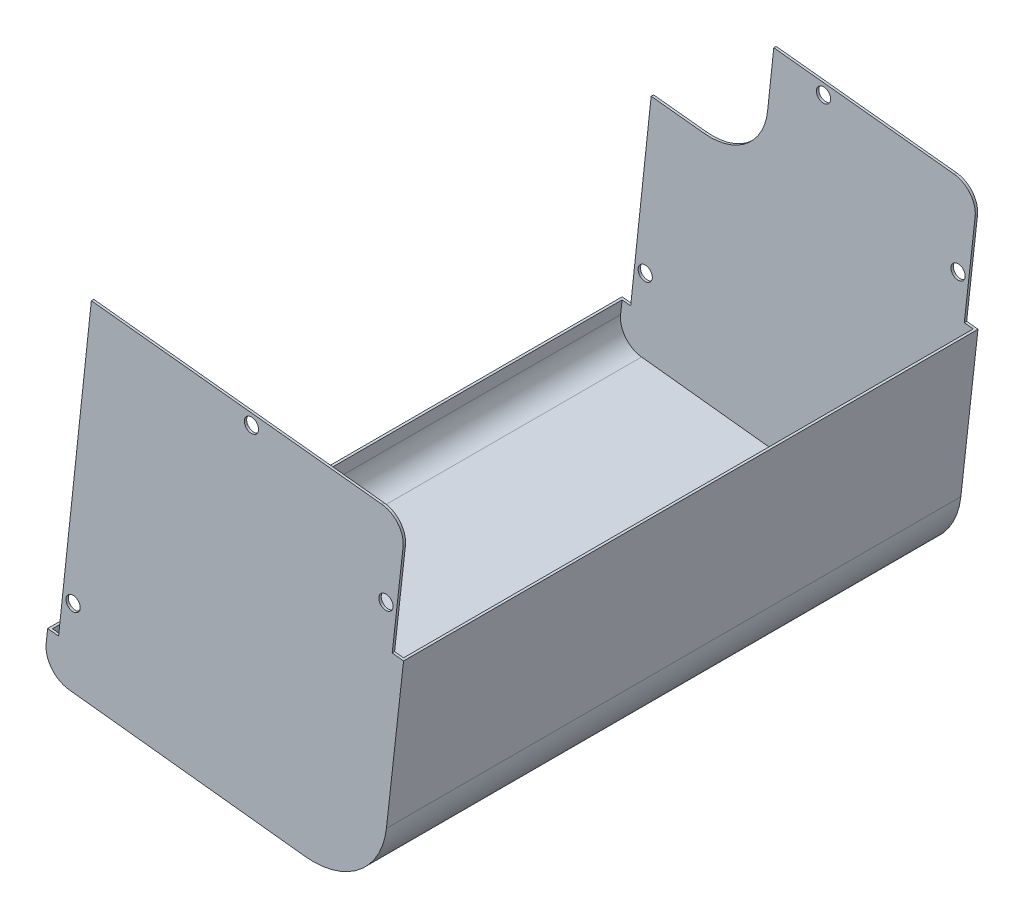
from build123d import *

# Parameters (mm, degrees)
EXTRUDE_1_DEPTH     = 240
SHELL_1_T           = 1
CUT_EXTRUDE_1_DEPTH = 10
SKETCH_3_R          = 3.0000000000000018
SKETCH_3_R_2        = 3.000000000000008
CUT_EXTRUDE_2_DEPTH = 10
CUT_EXTRUDE_START   = -8
SKETCH_6_R          = 3.0000000000000018
SKETCH_6_R_2        = 3.000000000000008
CUT_EXTRUDE_4_DEPTH = 8


with BuildPart() as part:
    # 草图1 → 凸台-拉伸1 (new body)
    with BuildSketch(Plane.XY):
        with BuildLine():
            Line((-59.31594071221176, -68.02781651157832), (-59.9536030402972, -73.74672011248332))
            ThreePointArc((-59.9536030402972, -73.74672011248332), (-57.826283597547295, -81.098805241968), (-51.12333234290943, -84.79327248916888))
            Line((-51.12333234290943, -84.79327248916888), (48.260783027457215, -95.87468088565784))
            ThreePointArc((48.260783027457215, -95.87468088565784), (70.3170384159113, -89.49272255740806), (81.40044015751394, -69.38386879349436))
            Line((81.40044015751394, -69.38386879349436), (88.61365635961639, -4.691811108090497))
            Line((88.61365635961639, -4.691811108090497), (84.83705997568286, -4.270717589039598))
            Line((84.83705997568286, -4.270717589039598), (89.4084892426148, 36.72835377657124))
            ThreePointArc((89.4084892426148, 36.72835377657124), (87.266542040995, 44.098694219102335), (80.53170892213036, 47.77998188979318))
            Line((80.53170892213036, 47.77998188979318), (-41.90893576965496, 60.852539535143315))
            Line((-41.90893576965496, 60.852539535143315), (-55.71014158484277, -68.41279502152355))
            Line((-55.71014158484277, -68.41279502152355), (-59.190362130599055, -68.04122409572891))
            Line((-59.190362130599055, -68.04122409572891), (-59.31594071221176, -68.02781651157832))
        make_face()
    extrude(amount=EXTRUDE_1_DEPTH)

    # 抽壳1
    shell_1_openings = [part.faces().sort_by_distance(p)[0] for p in [
        (-48.809538677, -3.780127743, 120),
        (19.311386576, 54.316260712, 120),
        (87.266542041, 44.098694219, 120),
        (87.122774609, 16.228818094, 120),
        (86.725358168, -4.481264349, 120),
        (-57.513041149, -68.220305767, 120),
    ]]
    offset(amount=SHELL_1_T, openings=shell_1_openings, kind=Kind.INTERSECTION)

    # 草图2 → 切除-拉伸1 (cut)
    with BuildSketch(Plane(origin=(0, 0, -1), x_dir=(-1, 0, 0), z_dir=(0, 0, -1))):
        with BuildLine():
            Line((47.084151642276574, 12.380252393304023), (24.71130527686598, 9.991582155982451))
            ThreePointArc((24.71130527686598, 9.991582155982451), (6.908463771051354, 15.233207386949033), (-1.9736574368444393, 31.528106085354896))
            Line((-1.9736574368444393, 31.528106085354896), (-4.574653917520899, 55.88964990582092))
            Line((-4.574653917520899, 55.88964990582092), (41.90893576965496, 60.852539535143315))
            Line((41.90893576965496, 60.852539535143315), (47.084151642276574, 12.380252393304023))
        make_face()
    extrude(amount=-CUT_EXTRUDE_1_DEPTH, mode=Mode.SUBTRACT)

    # 草图3 → 切除-拉伸2 (cut)
    with BuildSketch(Plane(origin=(0, 0, -1), x_dir=(-1, 0, 0), z_dir=(0, 0, -1))):
        with Locations((-25.52734826155789, 49.12702905294972)):
            Circle(SKETCH_3_R)
        with Locations((-82.20224799889411, 12.905547308509762)):
            Circle(SKETCH_3_R_2)
        with Locations((49.590043926063395, -53.47812379490241)):
            Circle(SKETCH_3_R)
    extrude(amount=-CUT_EXTRUDE_2_DEPTH, mode=Mode.SUBTRACT)

    # 草图6 → 切除-拉伸4 (cut)
    with BuildSketch(Plane.XY.offset(241).offset(CUT_EXTRUDE_START)):
        with Locations(Location((25.52734826155789, 49.12702905294972, 0), (0, 0, 180))):
            Circle(SKETCH_6_R)
        with Locations(Location((82.20224799889411, 12.905547308509762, 0), (0, 0, 180))):
            Circle(SKETCH_6_R_2)
        with Locations(Location((-49.590043926063395, -53.47812379490241, 0), (0, 0, 180))):
            Circle(SKETCH_6_R)
    extrude(amount=CUT_EXTRUDE_4_DEPTH, mode=Mode.SUBTRACT)


solid = part.part
